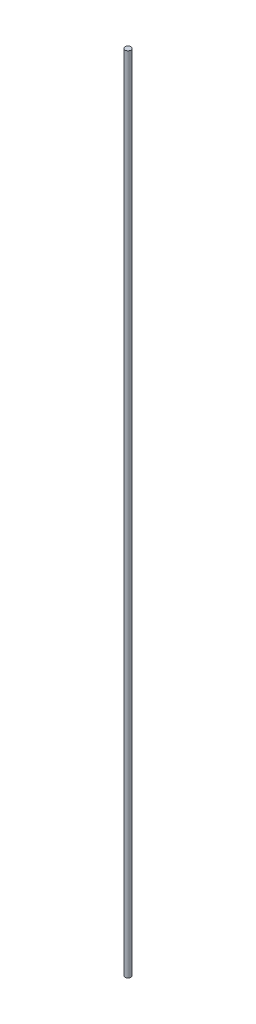
from build123d import *

# Parameters (mm, degrees)
SKETCH1_R           = 1.13
BOSS_EXTRUDE1_DEPTH = 304.8


with BuildPart() as part:
    # Sketch1 → Boss-Extrude1 (new body)
    with BuildSketch(Plane(origin=(0, 0, 0), x_dir=(1, 0, 0), z_dir=(0, 1, 0))):
        with Locations(Location((0, 0, 0), (0, 0, 90))):
            Circle(SKETCH1_R)
    extrude(amount=BOSS_EXTRUDE1_DEPTH)


solid = part.part
